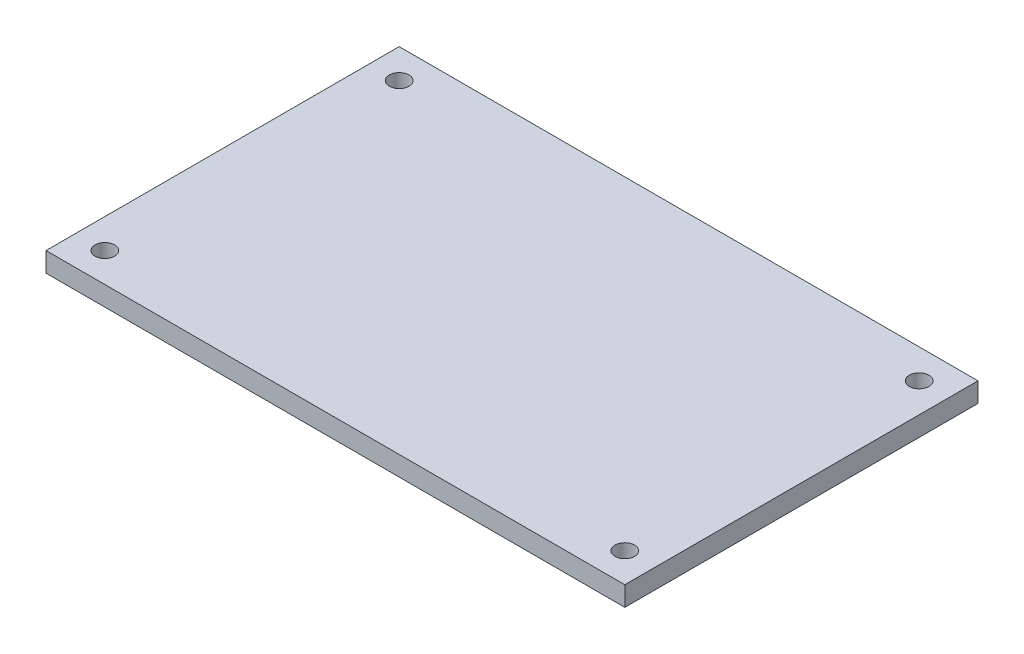
from build123d import *

# Parameters (mm, degrees)
SKETCH1_W                      = 374.65
SKETCH1_H                      = 228.6
BOSS_EXTRUDE1_DEPTH            = 12.7
F_1_2_0_5000_DOWEL_HOLE1_D     = 12.7
F_1_2_0_5000_DOWEL_HOLE1_DEPTH = 12.7
F_1_2_0_5000_DOWEL_HOLE1_TIP   = 3.815464931


with BuildPart() as part:
    # Sketch1 → Boss-Extrude1 (new body)
    with BuildSketch(Plane(origin=(0, 0, 0), x_dir=(1, 0, 0), z_dir=(0, 1, 0))):
        Rectangle(SKETCH1_W, SKETCH1_H)
    extrude(amount=BOSS_EXTRUDE1_DEPTH)

    # 1/2 (0.5000) Dowel Hole1
    with Locations(Plane(origin=(0, 12.7, 0), x_dir=(1, 0, 0), z_dir=(0, 1, 0))):
        with Locations((-168.275, 95.25), (-168.275, -95.25), (168.275, -95.25), (168.275, 95.25)):
            Hole(F_1_2_0_5000_DOWEL_HOLE1_D / 2, depth=F_1_2_0_5000_DOWEL_HOLE1_DEPTH)
            with Locations((0, 0, -(F_1_2_0_5000_DOWEL_HOLE1_DEPTH + F_1_2_0_5000_DOWEL_HOLE1_TIP / 2))):  # 118° drill point
                Cone(0, F_1_2_0_5000_DOWEL_HOLE1_D / 2, F_1_2_0_5000_DOWEL_HOLE1_TIP, mode=Mode.SUBTRACT)


solid = part.part
